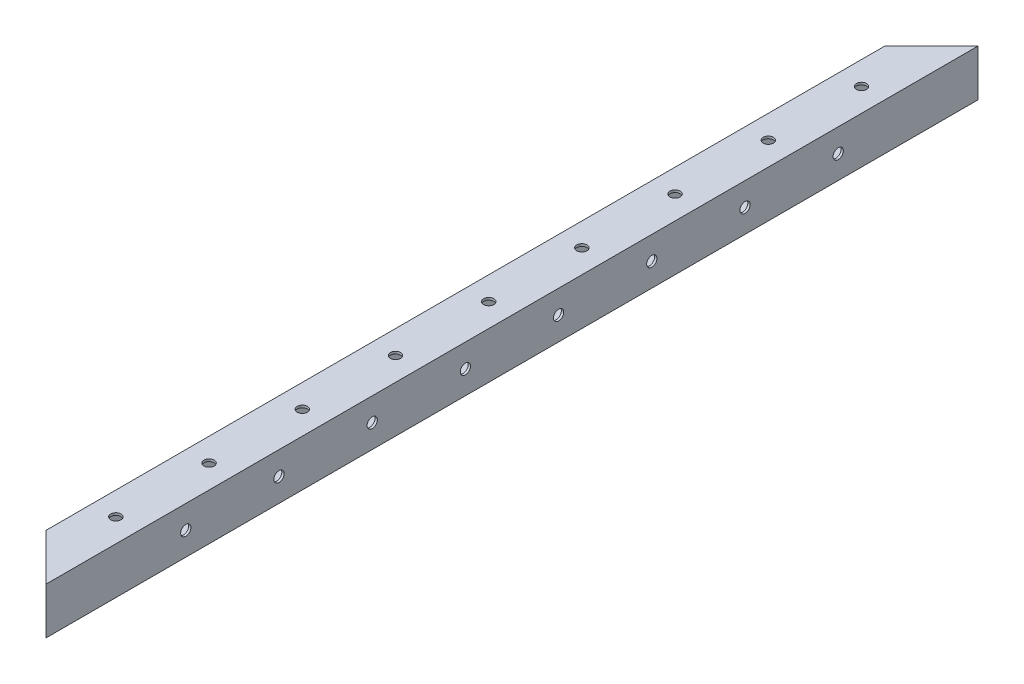
from build123d import *

# Parameters (mm, degrees)
SKETCH_1_R          = 2.2
EXTRUDE_1_DEPTH     = 5
CUT_EXTRUDE_2_DEPTH = 5
SKETCH_3_W          = 20
SKETCH_3_H          = 15
EXTRUDE_2_DEPTH     = 400
SKETCH_4_W          = 18
SKETCH_4_H          = 18
CUT_EXTRUDE_4_DEPTH = 400
CUT_EXTRUDE_5_DEPTH = 400
CUT_EXTRUDE_START   = -400
SKETCH_6_R          = 2.2
CUT_EXTRUDE_6_DEPTH = 400
SKETCH_7_R          = 2.2
CUT_EXTRUDE_7_DEPTH = 40


with BuildPart() as part:
    # 草图1 → 凸台-拉伸1 (new body)
    with BuildSketch(Plane(origin=(0, 0, 0), x_dir=(1, 0, 0), z_dir=(0, 1, 0))):
        Polygon((40, 200), (80, 200), (80, 205), (120, 205), (120, 200), (160, 200), (160, 205), (200, 205), (205, 205), (205, 200), (205, 160), (200, 160), (200, 120), (205, 120), (205, 80), (200, 80), (200, 40), (205, 40), (205, -40), (200, -40), (200, -80), (205, -80), (205, -120), (200, -120), (200, -160), (205, -160), (205, -200), (205, -205), (200, -205), (160, -205), (160, -200), (120, -200), (120, -205), (80, -205), (80, -200), (40, -200), (40, -205), (-40, -205), (-40, -200), (-80, -200), (-80, -205), (-120, -205), (-120, -200), (-160, -200), (-160, -205), (-200, -205), (-205, -205), (-205, -200), (-205, -160), (-200, -160), (-200, -120), (-205, -120), (-205, -80), (-200, -80), (-200, -40), (-205, -40), (-205, 40), (-200, 40), (-200, 80), (-205, 80), (-205, 120), (-200, 120), (-200, 160), (-205, 160), (-205, 200), (-205, 205), (-200, 205), (-160, 205), (-160, 200), (-120, 200), (-120, 205), (-80, 205), (-80, 200), (-40, 200), (-40, 205), (40, 205), align=None)
        with Locations(Location((-190, 0, 0), (0, 0, 270))):
            Circle(SKETCH_1_R, mode=Mode.SUBTRACT)
        with Locations(Location((-190, 40, 0), (0, 0, 270))):
            Circle(SKETCH_1_R, mode=Mode.SUBTRACT)
        with Locations(Location((-190, 80, 0), (0, 0, 270))):
            Circle(SKETCH_1_R, mode=Mode.SUBTRACT)
        with Locations(Location((-190, 120, 0), (0, 0, 270))):
            Circle(SKETCH_1_R, mode=Mode.SUBTRACT)
        with Locations(Location((-190, 160, 0), (0, 0, 270))):
            Circle(SKETCH_1_R, mode=Mode.SUBTRACT)
        with Locations(Location((-190, -160, 0), (0, 0, 270))):
            Circle(SKETCH_1_R, mode=Mode.SUBTRACT)
        with Locations(Location((-190, -120, 0), (0, 0, 270))):
            Circle(SKETCH_1_R, mode=Mode.SUBTRACT)
        with Locations(Location((-190, -80, 0), (0, 0, 270))):
            Circle(SKETCH_1_R, mode=Mode.SUBTRACT)
        with Locations(Location((-190, -40, 0), (0, 0, 270))):
            Circle(SKETCH_1_R, mode=Mode.SUBTRACT)
        with Locations(Location((0, 190, 0), (0, 0, 270))):
            Circle(SKETCH_1_R, mode=Mode.SUBTRACT)
        with Locations(Location((40, 190, 0), (0, 0, 270))):
            Circle(SKETCH_1_R, mode=Mode.SUBTRACT)
        with Locations(Location((80, 190, 0), (0, 0, 270))):
            Circle(SKETCH_1_R, mode=Mode.SUBTRACT)
        with Locations(Location((120, 190, 0), (0, 0, 270))):
            Circle(SKETCH_1_R, mode=Mode.SUBTRACT)
        with Locations(Location((160, 190, 0), (0, 0, 270))):
            Circle(SKETCH_1_R, mode=Mode.SUBTRACT)
        with Locations(Location((-160, 190, 0), (0, 0, 270))):
            Circle(SKETCH_1_R, mode=Mode.SUBTRACT)
        with Locations(Location((-120, 190, 0), (0, 0, 270))):
            Circle(SKETCH_1_R, mode=Mode.SUBTRACT)
        with Locations(Location((-80, 190, 0), (0, 0, 270))):
            Circle(SKETCH_1_R, mode=Mode.SUBTRACT)
        with Locations(Location((-40, 190, 0), (0, 0, 270))):
            Circle(SKETCH_1_R, mode=Mode.SUBTRACT)
        with Locations(Location((190, 0, 0), (0, 0, 270))):
            Circle(SKETCH_1_R, mode=Mode.SUBTRACT)
        with Locations(Location((190, -40, 0), (0, 0, 270))):
            Circle(SKETCH_1_R, mode=Mode.SUBTRACT)
        with Locations(Location((190, -80, 0), (0, 0, 270))):
            Circle(SKETCH_1_R, mode=Mode.SUBTRACT)
        with Locations(Location((190, -120, 0), (0, 0, 270))):
            Circle(SKETCH_1_R, mode=Mode.SUBTRACT)
        with Locations(Location((190, -160, 0), (0, 0, 270))):
            Circle(SKETCH_1_R, mode=Mode.SUBTRACT)
        with Locations(Location((190, 160, 0), (0, 0, 270))):
            Circle(SKETCH_1_R, mode=Mode.SUBTRACT)
        with Locations(Location((190, 120, 0), (0, 0, 270))):
            Circle(SKETCH_1_R, mode=Mode.SUBTRACT)
        with Locations(Location((190, 80, 0), (0, 0, 270))):
            Circle(SKETCH_1_R, mode=Mode.SUBTRACT)
        with Locations(Location((190, 40, 0), (0, 0, 270))):
            Circle(SKETCH_1_R, mode=Mode.SUBTRACT)
        with Locations(Location((0, -190, 0), (0, 0, 270))):
            Circle(SKETCH_1_R, mode=Mode.SUBTRACT)
        with Locations(Location((-40, -190, 0), (0, 0, 270))):
            Circle(SKETCH_1_R, mode=Mode.SUBTRACT)
        with Locations(Location((-80, -190, 0), (0, 0, 270))):
            Circle(SKETCH_1_R, mode=Mode.SUBTRACT)
        with Locations(Location((-120, -190, 0), (0, 0, 270))):
            Circle(SKETCH_1_R, mode=Mode.SUBTRACT)
        with Locations(Location((-160, -190, 0), (0, 0, 270))):
            Circle(SKETCH_1_R, mode=Mode.SUBTRACT)
        with Locations(Location((160, -190, 0), (0, 0, 270))):
            Circle(SKETCH_1_R, mode=Mode.SUBTRACT)
        with Locations(Location((120, -190, 0), (0, 0, 270))):
            Circle(SKETCH_1_R, mode=Mode.SUBTRACT)
        with Locations(Location((80, -190, 0), (0, 0, 270))):
            Circle(SKETCH_1_R, mode=Mode.SUBTRACT)
        with Locations(Location((40, -190, 0), (0, 0, 270))):
            Circle(SKETCH_1_R, mode=Mode.SUBTRACT)
    extrude(amount=EXTRUDE_1_DEPTH)

    # 草图2 → 切除-拉伸2 (cut)
    with BuildSketch(Plane(origin=(0, 5, 0), x_dir=(1, 0, 0), z_dir=(0, 1, 0))):
        Polygon((-262.338764773, 278.332609162), (-269.219830918, -271.432403188), (296.387975763, -278.51176372), (303.269041909, 271.25324863), align=None)
        Polygon((-180, -180), (-180, -200), (-200, -200), (-200, -160), (-200, 200), (-180, 200), (-180, 180), (-180, -160), align=None, mode=Mode.SUBTRACT)
    extrude(amount=-CUT_EXTRUDE_2_DEPTH, mode=Mode.SUBTRACT)

    # 草图3 → 凸台-拉伸2 (add)
    with BuildSketch(Plane.XY.offset(200)):
        with Locations((-190, -7.5)):
            Rectangle(SKETCH_3_W, SKETCH_3_H)
    extrude(amount=-EXTRUDE_2_DEPTH)

    # 草图4 → 切除-拉伸4 (cut)
    with BuildSketch(Plane.XY.offset(200)):
        with Locations((-190, -5)):
            Rectangle(SKETCH_4_W, SKETCH_4_H)
    extrude(amount=-CUT_EXTRUDE_4_DEPTH, mode=Mode.SUBTRACT)

    # 草图5 → 切除-拉伸5 (cut)
    with BuildSketch(Plane(origin=(0, 5, 0), x_dir=(1, 0, 0), z_dir=(0, 1, 0))):
        Polygon((-180, -200), (-200, -180), (-200, -200), align=None)
        Polygon((-200, 200), (-180, 200), (-200, 180), align=None)
    extrude(amount=-CUT_EXTRUDE_5_DEPTH, mode=Mode.SUBTRACT)

    # 草图6 → 切除-拉伸6 (cut)
    with BuildSketch(Plane(origin=(0, 5, 0), x_dir=(1, 0, 0), z_dir=(0, 1, 0)).offset(CUT_EXTRUDE_START)):
        with Locations(Location((-190, 160, 0), (0, 0, 90))):
            Circle(SKETCH_6_R)
        with Locations(Location((-190, 120, 0), (0, 0, 90))):
            Circle(SKETCH_6_R)
        with Locations(Location((-190, 80, 0), (0, 0, 90))):
            Circle(SKETCH_6_R)
        with Locations(Location((-190, 40, 0), (0, 0, 90))):
            Circle(SKETCH_6_R)
        with Locations(Location((-190, 0, 0), (0, 0, 90))):
            Circle(SKETCH_6_R)
        with Locations(Location((-190, -40, 0), (0, 0, 90))):
            Circle(SKETCH_6_R)
        with Locations(Location((-190, -80, 0), (0, 0, 90))):
            Circle(SKETCH_6_R)
        with Locations(Location((-190, -120, 0), (0, 0, 90))):
            Circle(SKETCH_6_R)
        with Locations(Location((-190, -160, 0), (0, 0, 90))):
            Circle(SKETCH_6_R)
    extrude(amount=CUT_EXTRUDE_6_DEPTH, mode=Mode.SUBTRACT)

    # 草图7 → 切除-拉伸7 (cut)
    with BuildSketch(Plane.ZY.offset(200)):
        with Locations((-140, -5)):
            Circle(SKETCH_7_R)
        with Locations((-100, -5)):
            Circle(SKETCH_7_R)
        with Locations((-60, -5)):
            Circle(SKETCH_7_R)
        with Locations((-20, -5)):
            Circle(SKETCH_7_R)
        with Locations((20, -5)):
            Circle(SKETCH_7_R)
        with Locations((60, -5)):
            Circle(SKETCH_7_R)
        with Locations((100, -5)):
            Circle(SKETCH_7_R)
        with Locations((140, -5)):
            Circle(SKETCH_7_R)
    extrude(amount=-CUT_EXTRUDE_7_DEPTH, mode=Mode.SUBTRACT)


solid = part.part
